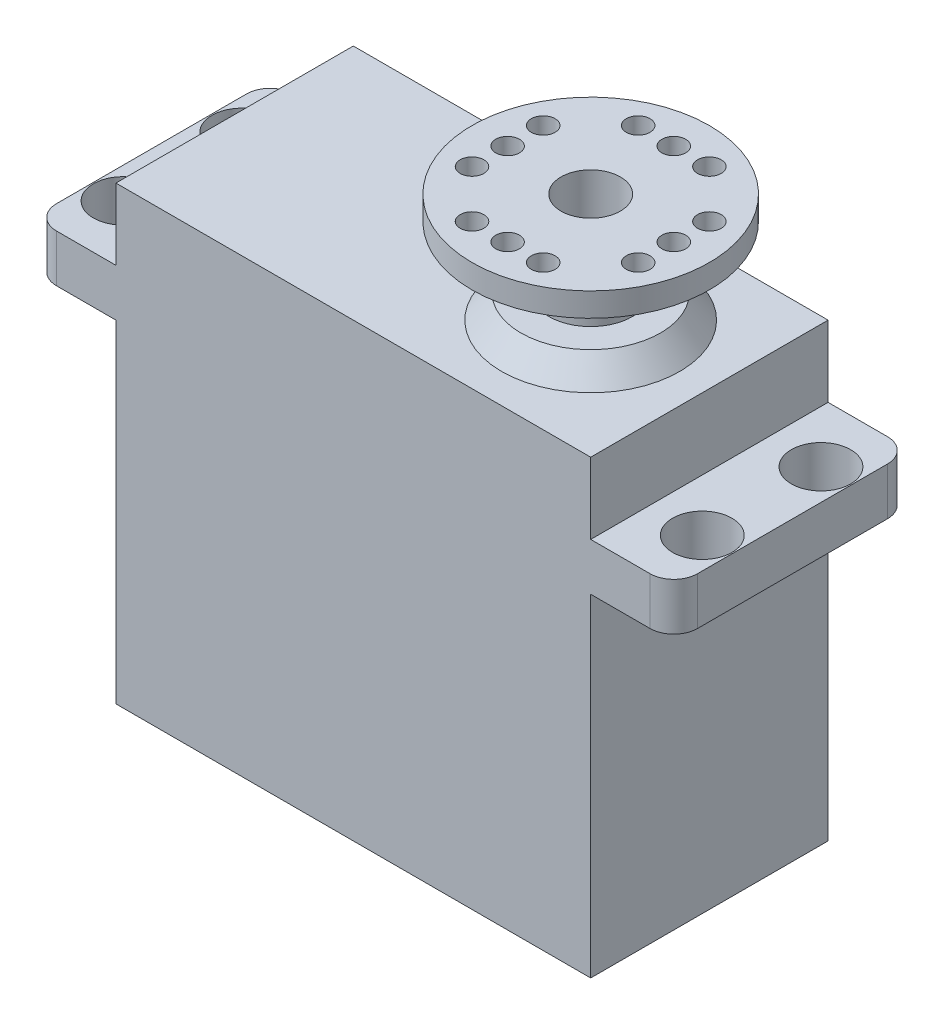
from build123d import *

# Parameters (mm, degrees)
SKETCH1_W           = 40
SKETCH1_H           = 20
BOSS_EXTRUDE1_DEPTH = 38
SKETCH2_W           = 20
SKETCH2_H           = 4
BOSS_EXTRUDE2_DEPTH = 27
SKETCH3_R           = 2.5
CUT_EXTRUDE5_DEPTH  = 53.6
SKETCH4_R           = 7.5
BOSS_EXTRUDE3_DEPTH = 2
BOSS_EXTRUDE3_TAPER = 39
SKETCH5_R           = 3.5
BOSS_EXTRUDE4_DEPTH = 5.2
SKETCH6_R           = 10
BOSS_EXTRUDE5_DEPTH = 2
FILLET1_R           = 2
SKETCH7_R           = 2.5
SKETCH7_R_2         = 1
CUT_EXTRUDE9_DEPTH  = 6


with BuildPart() as part:
    # Sketch1 → Boss-Extrude1 (new body)
    with BuildSketch(Plane(origin=(0, 0, 0), x_dir=(1, 0, 0), z_dir=(0, 1, 0))):
        Rectangle(SKETCH1_W, SKETCH1_H)
    extrude(amount=BOSS_EXTRUDE1_DEPTH)

    # Sketch2 → Boss-Extrude2 (add, symmetric)
    with BuildSketch(Plane(origin=(0, 0, 0), x_dir=(0, 0, -1), z_dir=(1, 0, 0))):
        with Locations((0, 30)):
            Rectangle(SKETCH2_W, SKETCH2_H)
    extrude(amount=BOSS_EXTRUDE2_DEPTH, both=True)

    # Sketch3 → Cut-Extrude5 (cut)
    with BuildSketch(Plane(origin=(0, 32, 0), x_dir=(1, 0, 0), z_dir=(0, 1, 0))):
        with Locations(Location((24.4, 5, 0), (0, 0, 270))):
            Circle(SKETCH3_R)
        with Locations(Location((24.4, -5, 0), (0, 0, 270))):
            Circle(SKETCH3_R)
    cut_extrude5 = extrude(amount=-CUT_EXTRUDE5_DEPTH, mode=Mode.SUBTRACT)

    # Mirror1: Cut-Extrude5 across plane
    add(cut_extrude5.mirror(Plane(origin=(0, 0, 0), x_dir=(0, 0, 1), z_dir=(1, 0, 0))), mode=Mode.SUBTRACT)

    # Sketch4 → Boss-Extrude3 (add)
    with BuildSketch(Plane(origin=(0, 38, 0), x_dir=(1, 0, 0), z_dir=(0, 1, 0))):
        with Locations((10, 0)):
            Circle(SKETCH4_R)
    extrude(amount=BOSS_EXTRUDE3_DEPTH, taper=BOSS_EXTRUDE3_TAPER)

    # Sketch5 → Boss-Extrude4 (add)
    with BuildSketch(Plane(origin=(0, 40, 0), x_dir=(1, 0, 0), z_dir=(0, 1, 0))):
        with Locations(Location((10, 0, 0), (0, 0, 270))):
            Circle(SKETCH5_R)
    extrude(amount=BOSS_EXTRUDE4_DEPTH)

    # Sketch6 → Boss-Extrude5 (add)
    with BuildSketch(Plane(origin=(0, 45.2, 0), x_dir=(1, 0, 0), z_dir=(0, 1, 0))):
        with Locations(Location((10, 0, 0), (0, 0, 270))):
            Circle(SKETCH6_R)
    extrude(amount=BOSS_EXTRUDE5_DEPTH)

    # Fillet1
    fillet1_edges = [part.edges().sort_by_distance(p)[0] for p in [
        (-27, 30, -10),
        (-27, 30, 10),
        (27, 30, -10),
        (27, 30, 10),
    ]]
    fillet(fillet1_edges, radius=FILLET1_R)

    # Sketch7 → Cut-Extrude9 (cut)
    with BuildSketch(Plane(origin=(0, 47.2, 0), x_dir=(1, 0, 0), z_dir=(0, 1, 0))):
        with Locations(Location((10, 0, 0), (0, 0, 270))):
            Circle(SKETCH7_R)
        with Locations(Location((10, 7, 0), (0, 0, 270))):
            Circle(SKETCH7_R_2)
        with Locations(Location((13, 7, 0), (0, 0, 270))):
            Circle(SKETCH7_R_2)
        with Locations(Location((7, 7, 0), (0, 0, 270))):
            Circle(SKETCH7_R_2)
        with Locations(Location((17, 3, 0), (0, 0, 270))):
            Circle(SKETCH7_R_2)
        with Locations(Location((17, 0, 0), (0, 0, 270))):
            Circle(SKETCH7_R_2)
        with Locations(Location((17, -3, 0), (0, 0, 270))):
            Circle(SKETCH7_R_2)
        with Locations(Location((13, -7, 0), (0, 0, 270))):
            Circle(SKETCH7_R_2)
        with Locations(Location((10, -7, 0), (0, 0, 270))):
            Circle(SKETCH7_R_2)
        with Locations(Location((7, -7, 0), (0, 0, 270))):
            Circle(SKETCH7_R_2)
        with Locations(Location((3, -3, 0), (0, 0, 270))):
            Circle(SKETCH7_R_2)
        with Locations(Location((3, 0, 0), (0, 0, 270))):
            Circle(SKETCH7_R_2)
        with Locations(Location((3, 3, 0), (0, 0, 270))):
            Circle(SKETCH7_R_2)
    extrude(amount=-CUT_EXTRUDE9_DEPTH, mode=Mode.SUBTRACT)


solid = part.part
